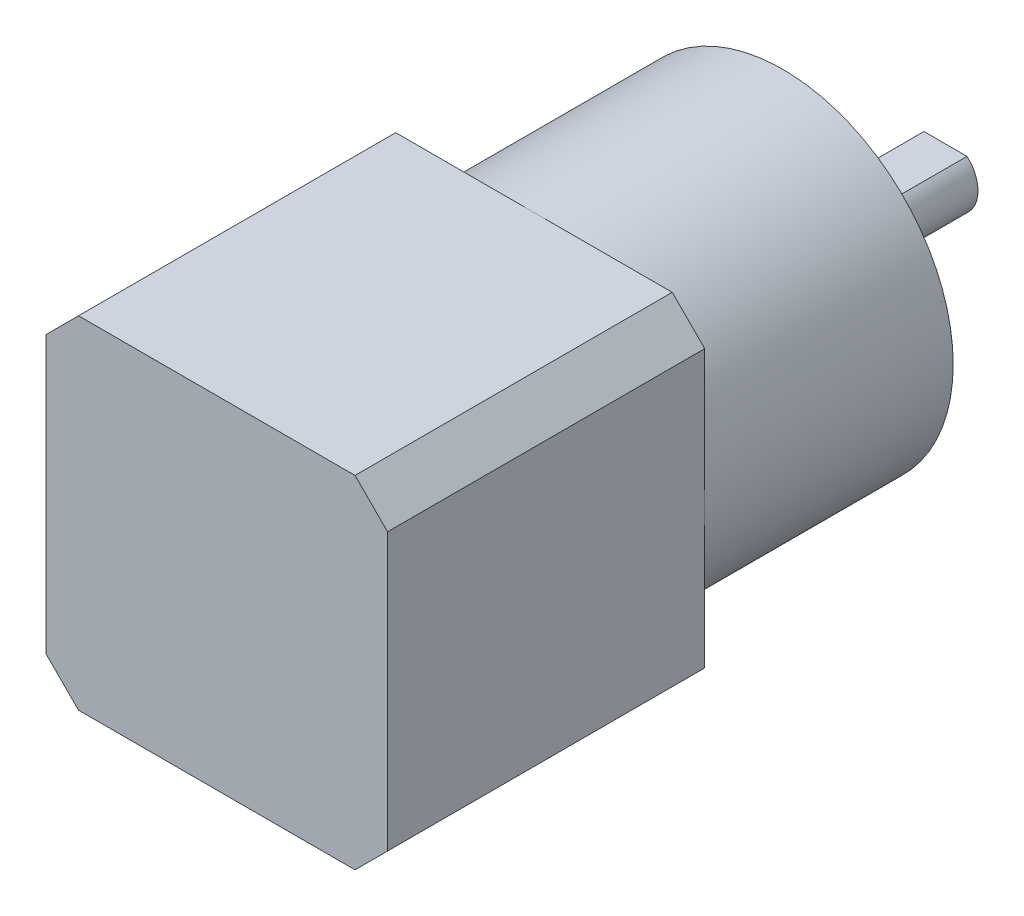
from build123d import *

# Parameters (mm, degrees)
SKETCH1_W           = 42
SKETCH1_H           = 42
BOSS_EXTRUDE1_DEPTH = 39
CHAMFER1_SIZE       = 4
SKETCH2_R           = 20.95
BOSS_EXTRUDE2_DEPTH = 30.6
SKETCH3_R           = 4
BOSS_EXTRUDE3_DEPTH = 20
CUT_EXTRUDE1_START  = -15
CUT_EXTRUDE1_DEPTH  = 15
SKETCH5_R           = 2
CUT_EXTRUDE2_DEPTH  = 20


with BuildPart() as part:
    # Sketch1 → Boss-Extrude1 (new body)
    with BuildSketch(Plane.XY):
        Rectangle(SKETCH1_W, SKETCH1_H)
    extrude(amount=BOSS_EXTRUDE1_DEPTH)

    # Chamfer1
    chamfer1_edges = [part.edges().sort_by_distance(p)[0] for p in [
        (21, -21, 19.5),
        (-21, -21, 19.5),
        (-21, 21, 19.5),
        (21, 21, 19.5),
    ]]
    chamfer(chamfer1_edges, length=CHAMFER1_SIZE)

    # Sketch2 → Boss-Extrude2 (add)
    with BuildSketch(Plane(origin=(0, 0, 0), x_dir=(-1, 0, 0), z_dir=(0, 0, -1))):
        Circle(SKETCH2_R)
    extrude(amount=BOSS_EXTRUDE2_DEPTH)

    # Sketch3 → Boss-Extrude3 (add)
    with BuildSketch(Plane(origin=(0, 0, -30.6), x_dir=(-1, 0, 0), z_dir=(0, 0, -1))):
        Circle(SKETCH3_R)
    extrude(amount=BOSS_EXTRUDE3_DEPTH)

    # Sketch4 → Cut-Extrude1 (cut)
    with BuildSketch(Plane(origin=(0, 0, -50.6), x_dir=(-1, 0, 0), z_dir=(0, 0, -1)).offset(CUT_EXTRUDE1_START)):
        with BuildLine():
            Line((-2.645751311, 3), (2.645751311, 3))
            ThreePointArc((2.645751311, 3), (0, 4), (-2.645751311, 3))
        make_face()
    extrude(amount=CUT_EXTRUDE1_DEPTH, mode=Mode.SUBTRACT)

    # Sketch5 → Cut-Extrude2 (cut)
    with BuildSketch(Plane(origin=(0, 0, -30.6), x_dir=(-1, 0, 0), z_dir=(0, 0, -1))):
        with Locations((12.02081528, 12.02081528)):
            Circle(SKETCH5_R)
        with Locations((12.02081528, -12.02081528)):
            Circle(SKETCH5_R)
        with Locations((-12.02081528, -12.02081528)):
            Circle(SKETCH5_R)
        with Locations((-12.02081528, 12.02081528)):
            Circle(SKETCH5_R)
    extrude(amount=-CUT_EXTRUDE2_DEPTH, mode=Mode.SUBTRACT)


solid = part.part
